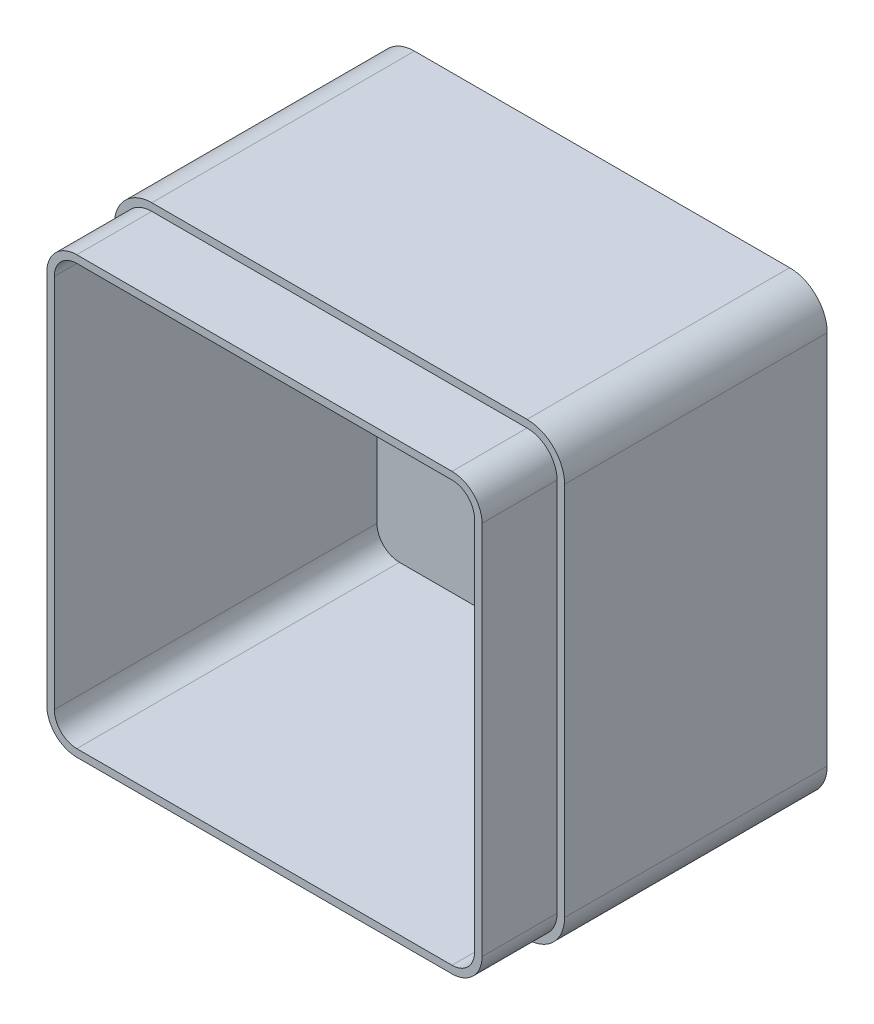
from build123d import *

# Parameters (mm, degrees)
SKETCH_1_W          = 120
SKETCH_1_H          = 120
EXTRUDE_1_DEPTH     = 90
FILLET_2_R          = 10
SHELL_2_T           = -4
CUT_EXTRUDE_2_DEPTH = 20


with BuildPart() as part:
    # 草图1 → 凸台-拉伸1 (new body)
    with BuildSketch(Plane.XY):
        with Locations((60, 60)):
            Rectangle(SKETCH_1_W, SKETCH_1_H)
    extrude(amount=EXTRUDE_1_DEPTH)

    # 圆角2
    fillet_2_edges = [part.edges().sort_by_distance(p)[0] for p in [
        (0, 120, 45),
        (120, 120, 45),
        (120, 0, 45),
        (0, 0, 45),
    ]]
    fillet(fillet_2_edges, radius=FILLET_2_R)

    # 抽壳2
    shell_2_openings = [part.faces().sort_by_distance(p)[0] for p in [
        (60, 60, 90),
    ]]
    offset(amount=SHELL_2_T, openings=shell_2_openings, kind=Kind.INTERSECTION)

    # 草图3 → 切除-拉伸2 (cut)
    with BuildSketch(Plane.XY.offset(90)):
        with BuildLine():
            Line((0, 110), (0, 10))
            ThreePointArc((0, 10), (2.928932188, 2.928932188), (10, 0))
            Line((10, 0), (110, 0))
            ThreePointArc((110, 0), (117.071067812, 2.928932188), (120, 10))
            Line((120, 10), (120, 110))
            ThreePointArc((120, 110), (117.071067812, 117.071067812), (110, 120))
            Line((110, 120), (10, 120))
            ThreePointArc((10, 120), (2.928932188, 117.071067812), (0, 110))
        make_face()
        with BuildLine():
            Line((2, 110), (2, 10))
            ThreePointArc((2, 10), (4.343145751, 4.343145751), (10, 2))
            Line((10, 2), (110, 2))
            ThreePointArc((110, 2), (115.656854249, 4.343145751), (118, 10))
            Line((118, 10), (118, 110))
            ThreePointArc((118, 110), (115.656854249, 115.656854249), (110, 118))
            Line((110, 118), (10, 118))
            ThreePointArc((10, 118), (4.343145751, 115.656854249), (2, 110))
        make_face(mode=Mode.SUBTRACT)
    extrude(amount=-CUT_EXTRUDE_2_DEPTH, mode=Mode.SUBTRACT)


solid = part.part
